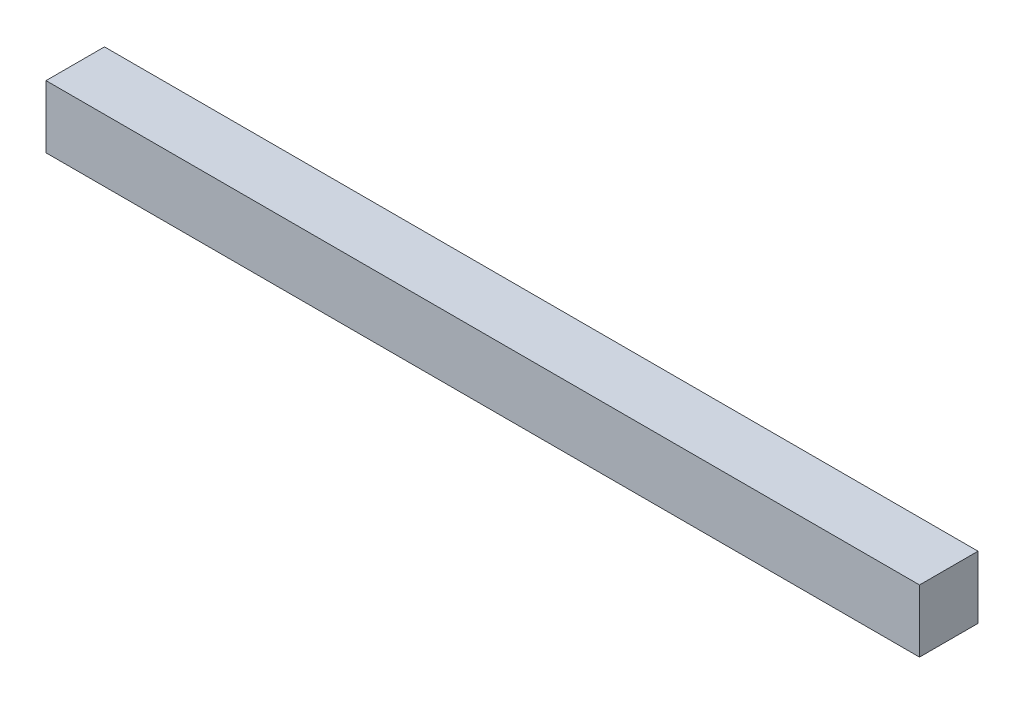
from build123d import *

# Parameters (mm, degrees)
SZKIC1_W                    = 149.393520872
SZKIC1_H                    = 10.694953115
DODANIE_WYCI_GNI_CIE1_DEPTH = 10


with BuildPart() as part:
    # Szkic1 → Dodanie-wyciągnięcie1 (new body)
    with BuildSketch(Plane.XY):
        with Locations((-452.001407156, -34.723390881)):
            Rectangle(SZKIC1_W, SZKIC1_H)
    extrude(amount=DODANIE_WYCI_GNI_CIE1_DEPTH)


solid = part.part
